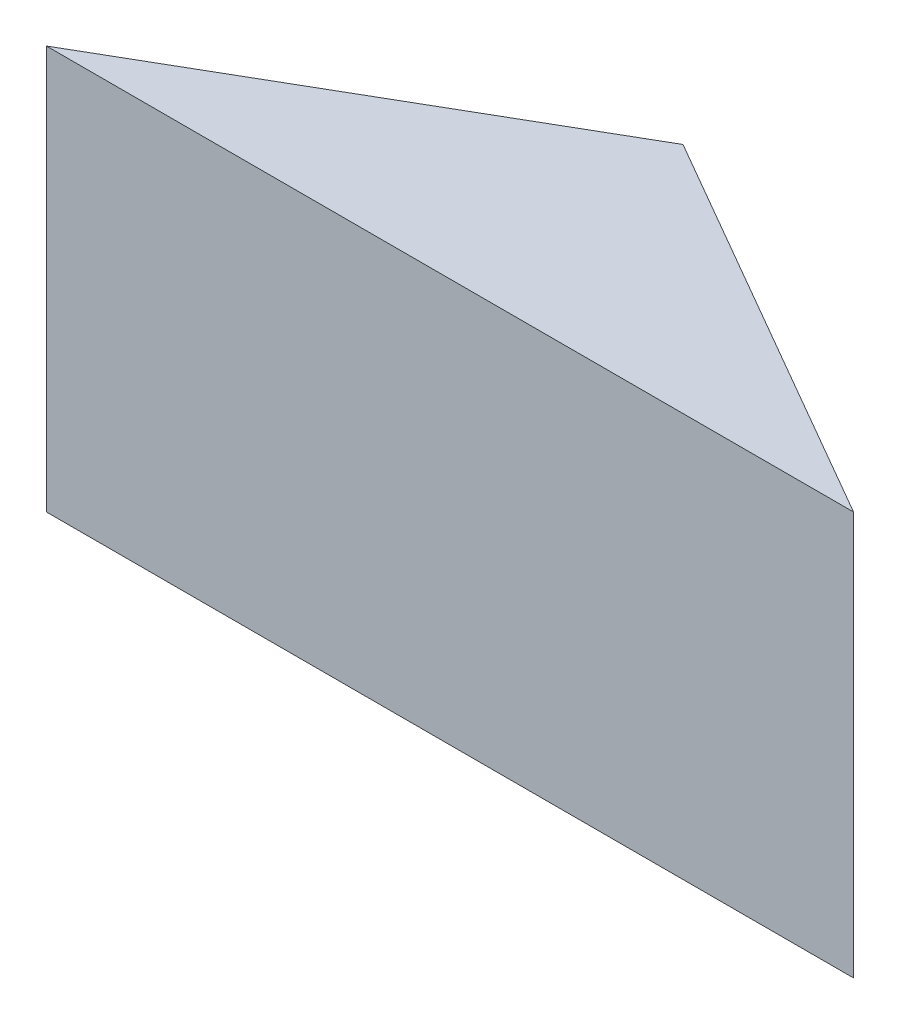
from build123d import *

# Parameters (mm, degrees)
BOSS_EXTRUDE1_DEPTH = 20


with BuildPart() as part:
    # Sketch1 → Boss-Extrude1 (new body)
    with BuildSketch(Plane(origin=(0, 0, 0), x_dir=(1, 0, 0), z_dir=(0, 1, 0))):
        Polygon((0, 11.547005384), (-20, 0), (0, 0), align=None)
        Polygon((0, 11.547005384), (0, 0), (20, 0), align=None)
    extrude(amount=BOSS_EXTRUDE1_DEPTH)


solid = part.part
